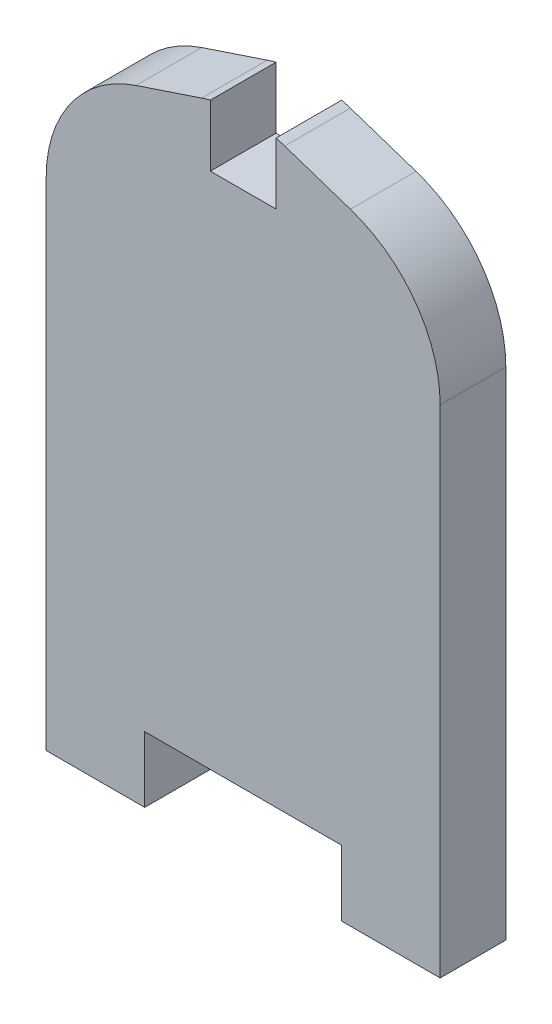
from build123d import *

# Parameters (mm, degrees)
BOSS_EXTRUDE1_DEPTH     = 6.35
FILLET1_R               = 12.7
CUT_EXTRUDE1_DEPTH      = 49.655987184
CUT_EXTRUDE1_DEPTH_BACK = 49.655987184
SKETCH5_W               = 6.35
SKETCH5_H               = 12.7


with BuildPart() as part:
    # Sketch1 → Boss-Extrude1 (new body)
    with BuildSketch(Plane.XY):
        Polygon((-9.525, -37.96907139), (9.525, -37.96907139), (9.525, -44.31907139), (19.05, -44.31907139), (19.05, -37.96907139), (19.05, 12.83092861), (0, 19.18092861), (-19.05, 12.83092861), (-19.05, -37.96907139), (-19.05, -44.31907139), (-9.525, -44.31907139), align=None)
    extrude(amount=BOSS_EXTRUDE1_DEPTH)

    # Fillet1
    fillet1_edges = [part.edges().sort_by_distance(p)[0] for p in [
        (-19.05, 12.83092861, 3.175),
        (0, 19.18092861, 3.175),
        (19.05, 12.83092861, 3.175),
    ]]
    fillet(fillet1_edges, radius=FILLET1_R)

    # Sketch5 → Cut-Extrude1 (cut, two sides: drawn at the far end of the back side and taken through both)
    with BuildSketch(Plane.XY.offset(6.35).offset(-CUT_EXTRUDE1_DEPTH_BACK)):
        with Locations((0, 18.493953182)):
            Rectangle(SKETCH5_W, SKETCH5_H)
    extrude(amount=CUT_EXTRUDE1_DEPTH + CUT_EXTRUDE1_DEPTH_BACK, mode=Mode.SUBTRACT)


solid = part.part
